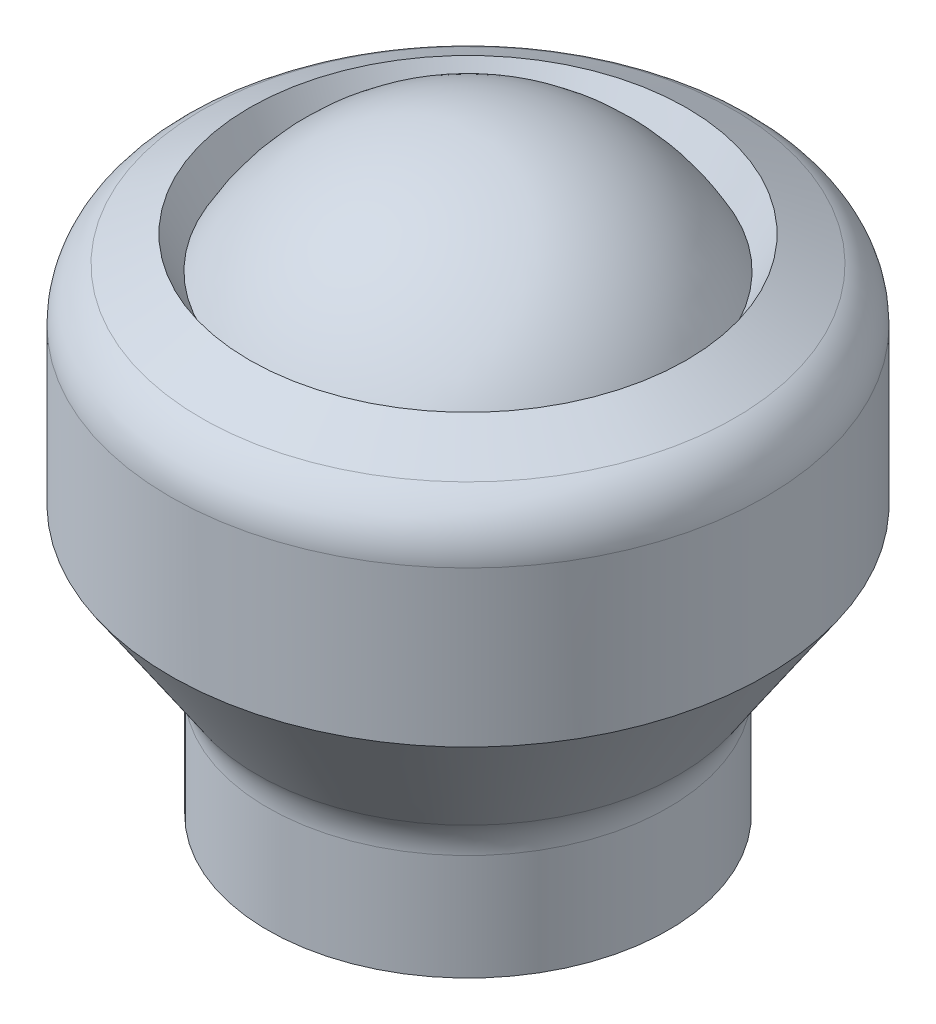
from build123d import *
from build123d.topology import SkipClean

# Parameters (mm, degrees)
FILLET_1_R = 2


with BuildPart() as part:
    # ｽｹｯﾁ1 → 回転1 (revolve)
    with SkipClean():  # the faces are left unmerged after this step: merging them gives an invalid solid
        with BuildSketch(Plane.XY, mode=Mode.PRIVATE) as revolve_1_sk:
            with BuildLine():
                ThreePointArc((41.145537471, 23.155045442), (38.343164799, 26.082487024), (34.436430544, 27.159814398))
                Line((34.436430544, 27.159814398), (34.436430544, 11.915416826))
                ThreePointArc((34.436430544, 11.915416826), (39.826138993, 14.147907163), (42.05862933, 19.537615612))
                ThreePointArc((42.05862933, 19.537615612), (41.826831785, 21.403060285), (41.145537471, 23.155045442))
            make_face()
            with BuildLine():
                Line((34.436430544, 11.915416826), (34.436430544, 27.159814398))
                ThreePointArc((34.436430544, 27.159814398), (26.814231757, 19.537615612), (34.436430544, 11.915416826))
            make_face()
            with BuildLine():
                ThreePointArc((42.05862933, 19.537615612), (39.826138993, 14.147907163), (34.436430544, 11.915416826))
                Line((34.436430544, 11.915416826), (34.436430544, 7.442165664))
                Line((34.436430544, 7.442165664), (34.436430544, 4.442165664))
                Line((34.436430544, 4.442165664), (36.436430544, 4.442165664))
                Line((36.436430544, 4.442165664), (36.436430544, 7.442165664))
                Line((36.436430544, 7.442165664), (41.127456758, 7.442165664))
                Line((41.127456758, 7.442165664), (41.127456758, 11.596223188))
                Line((41.127456758, 11.596223188), (44.380435509, 16.421475002))
                Line((44.380435509, 16.421475002), (44.380435509, 22.787256507))
                Line((44.380435509, 22.787256507), (41.735375917, 24.233678208))
                Line((41.735375917, 24.233678208), (41.145537471, 23.155045442))
                ThreePointArc((41.145537471, 23.155045442), (41.826831785, 21.403060285), (42.05862933, 19.537615612))
            make_face()
        revolve(revolve_1_sk.sketch.rotate(Axis((34.436430544, 27.159814398, 0), (0, -1, 0)), 180), axis=Axis((34.436430544, 27.159814398, 0), (0, -1, 0)))

    # ﾌｨﾚｯﾄ1
    fillet_1_edges = [part.edges().sort_by_distance(p)[0] for p in [
        (44.380435509, 22.787256507, 0),
        (41.127456758, 11.596223188, 0),
    ]]
    fillet(fillet_1_edges, radius=FILLET_1_R)


solid = part.part
